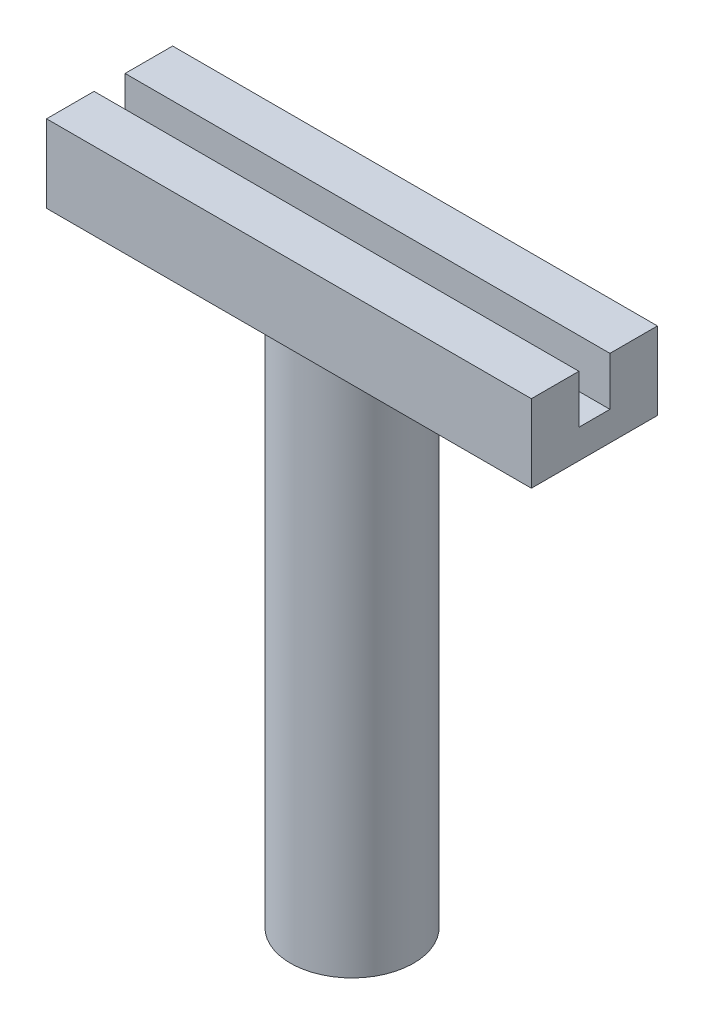
from build123d import *

# Parameters (mm, degrees)
SKETCH_1_W          = 50
SKETCH_1_H          = 13
EXTRUDE_1_DEPTH     = 8
SKETCH_2_R          = 6.35
EXTRUDE_2_DEPTH     = 55
SKETCH_3_W          = 50
SKETCH_3_H          = 3.2
CUT_EXTRUDE_1_DEPTH = 5


with BuildPart() as part:
    # 草图1 → 凸台-拉伸1 (new body)
    with BuildSketch(Plane(origin=(0, 0, 0), x_dir=(1, 0, 0), z_dir=(0, 1, 0))):
        Rectangle(SKETCH_1_W, SKETCH_1_H)
    extrude(amount=EXTRUDE_1_DEPTH)

    # 草图2 → 凸台-拉伸2 (add)
    with BuildSketch(Plane.XZ):
        with Locations(Location((0, 0, 0), (0, 0, 270))):
            Circle(SKETCH_2_R)
    extrude(amount=EXTRUDE_2_DEPTH)

    # 草图3 → 切除-拉伸1 (cut)
    with BuildSketch(Plane(origin=(0, 8, 0), x_dir=(1, 0, 0), z_dir=(0, 1, 0))):
        Rectangle(SKETCH_3_W, SKETCH_3_H)
    extrude(amount=-CUT_EXTRUDE_1_DEPTH, mode=Mode.SUBTRACT)


solid = part.part
